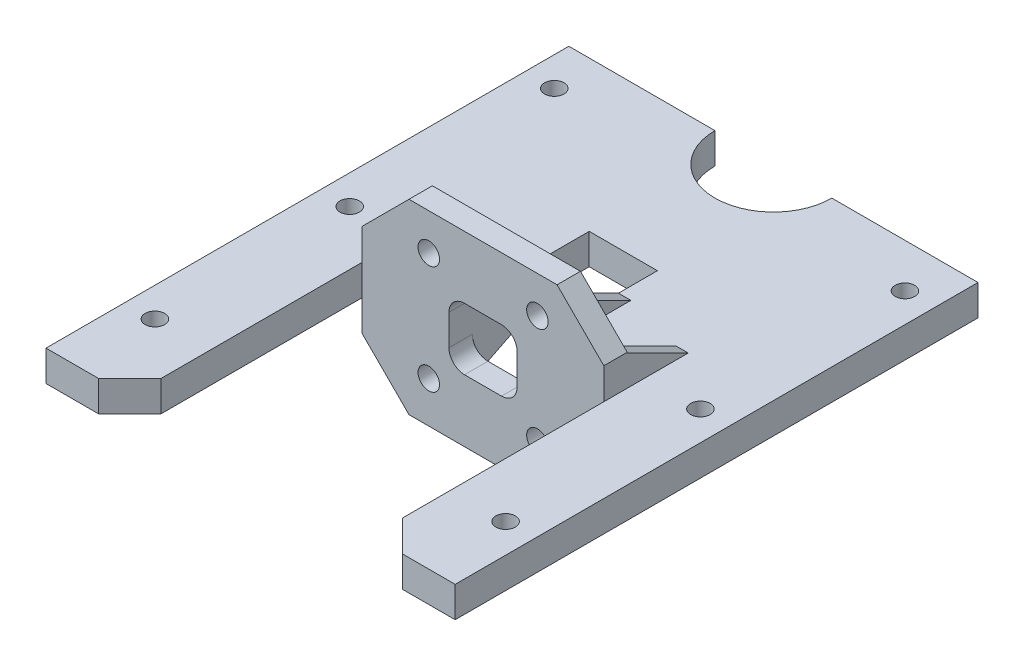
from build123d import *

# Parameters (mm, degrees)
SKETCH1_R           = 1.5875
BOSS_EXTRUDE1_DEPTH = 5
SKETCH2_W           = 39.37
SKETCH2_H           = 30.4
BOSS_EXTRUDE2_DEPTH = 3.81
SKETCH3_W           = 11.1125
SKETCH3_H           = 10.08
CUT_EXTRUDE1_DEPTH  = 3.81
FILLET1_R           = 2.54
CHAMFER1_SIZE       = 7.62
CHAMFER2_SIZE       = 5.08
BOSS_EXTRUDE3_DEPTH = 2.032
BOSS_EXTRUDE4_DEPTH = 2.032
BOSS_EXTRUDE5_DEPTH = 2.032
BOSS_EXTRUDE6_DEPTH = 2.032
SKETCH8_R           = 1.75
SKETCH8_R_2         = 1.7499965
CUT_EXTRUDE2_DEPTH  = 20.32
SKETCH9_R           = 3
CUT_EXTRUDE3_DEPTH  = 10.16
BOSS_EXTRUDE7_DEPTH = 2.032
BOSS_EXTRUDE8_DEPTH = 2.032


with BuildPart() as part:
    # Sketch1 → Boss-Extrude1 (new body)
    with BuildSketch(Plane(origin=(0, 0, 0), x_dir=(1, 0, 0), z_dir=(0, 1, 0))):
        with BuildLine():
            Line((-33.3375, 0), (-19.685, 0))
            Line((-19.685, 0), (-19.685, 41.68899781))
            Line((-19.685, 41.68899781), (-5.55625, 41.68899781))
            Line((-5.55625, 41.68899781), (-5.55625, 60.73899781))
            Line((-5.55625, 60.73899781), (5.55625, 60.73899781))
            Line((5.55625, 60.73899781), (5.55625, 41.68899781))
            Line((5.55625, 41.68899781), (19.685, 41.68899781))
            Line((19.685, 41.68899781), (19.685, 0))
            Line((19.685, 0), (33.3375, 0))
            Line((33.3375, 0), (33.3375, 85.198868165))
            Line((33.3375, 85.198868165), (9.525, 85.198868165))
            ThreePointArc((9.525, 85.198868165), (0, 75.673868165), (-9.525, 85.198868165))
            Line((-9.525, 85.198868165), (-33.3375, 85.198868165))
            Line((-33.3375, 85.198868165), (-33.3375, 0))
        make_face()
        with Locations(Location((-28.575, 12.975059538, 0), (0, 0, 270))):
            Circle(SKETCH1_R, mode=Mode.SUBTRACT)
        with Locations(Location((28.575, 12.975059538, 0), (0, 0, 270))):
            Circle(SKETCH1_R, mode=Mode.SUBTRACT)
        with Locations(Location((-28.575, 44.725059538, 0), (0, 0, 270))):
            Circle(SKETCH1_R, mode=Mode.SUBTRACT)
        with Locations(Location((-28.575, 78.062559538, 0), (0, 0, 270))):
            Circle(SKETCH1_R, mode=Mode.SUBTRACT)
        with Locations(Location((28.575, 44.725059538, 0), (0, 0, 270))):
            Circle(SKETCH1_R, mode=Mode.SUBTRACT)
        with Locations(Location((28.575, 78.062559538, 0), (0, 0, 270))):
            Circle(SKETCH1_R, mode=Mode.SUBTRACT)
    extrude(amount=BOSS_EXTRUDE1_DEPTH)

    # Sketch2 → Boss-Extrude2 (add)
    with BuildSketch(Plane.XY.offset(-41.68899781)):
        with Locations((0, 2.5)):
            Rectangle(SKETCH2_W, SKETCH2_H)
    extrude(amount=BOSS_EXTRUDE2_DEPTH)

    # Sketch3 → Cut-Extrude1 (cut)
    with BuildSketch(Plane(origin=(0, 0, -41.68899781), x_dir=(-1, 0, 0), z_dir=(0, 0, -1))):
        with Locations((0, 2.5)):
            Rectangle(SKETCH3_W, SKETCH3_H)
    extrude(amount=-CUT_EXTRUDE1_DEPTH, mode=Mode.SUBTRACT)

    # Fillet1
    fillet1_edges = [part.edges().sort_by_distance(p)[0] for p in [
        (5.55625, -2.54, -39.78399781),
        (-5.55625, -2.54, -39.78399781),
        (5.55625, 7.54, -39.78399781),
        (-5.55625, 7.54, -39.78399781),
    ]]
    fillet(fillet1_edges, radius=FILLET1_R)

    # Chamfer1
    chamfer1_edges = [part.edges().sort_by_distance(p)[0] for p in [
        (19.685, -12.7, -39.78399781),
        (-19.685, 17.7, -39.78399781),
        (-19.685, -12.7, -39.78399781),
        (19.685, 17.7, -39.78399781),
    ]]
    chamfer(chamfer1_edges, length=CHAMFER1_SIZE)

    # Chamfer2
    chamfer2_edges = [part.edges().sort_by_distance(p)[0] for p in [
        (19.685, 2.5, 0),
        (-19.685, 2.5, 0),
    ]]
    chamfer(chamfer2_edges, length=CHAMFER2_SIZE)

    # Sketch4 → Boss-Extrude3 (add)
    with BuildSketch(Plane.ZY.offset(-5.55625)):
        Polygon((-41.68899781, 5), (-54.38899781, 5), (-41.68899781, 11.35), align=None)
    extrude(amount=-BOSS_EXTRUDE3_DEPTH)

    # Sketch5 → Boss-Extrude4 (add)
    with BuildSketch(Plane(origin=(-5.55625, 0, 0), x_dir=(0, 0, -1), z_dir=(1, 0, 0))):
        Polygon((54.38899781, 5), (41.68899781, 5), (41.68899781, 11.35), align=None)
    extrude(amount=-BOSS_EXTRUDE4_DEPTH)

    # Sketch6 → Boss-Extrude5 (add)
    with BuildSketch(Plane(origin=(-5.55625, 0, 0), x_dir=(0, 0, -1), z_dir=(1, 0, 0))):
        Polygon((41.68899781, 0), (54.38899781, 0), (41.68899781, -6.35), align=None)
    extrude(amount=-BOSS_EXTRUDE5_DEPTH)

    # Sketch7 → Boss-Extrude6 (add)
    with BuildSketch(Plane.ZY.offset(-5.55625)):
        Polygon((-41.68899781, 0), (-54.38899781, 0), (-41.68899781, -6.35), align=None)
    extrude(amount=-BOSS_EXTRUDE6_DEPTH)

    # Sketch8 → Cut-Extrude2 (cut)
    with BuildSketch(Plane.XY.offset(-37.87899781)):
        with Locations((-8.841749375, 11.716378166)):
            Circle(SKETCH8_R)
        with Locations((8.85825, 11.721080704)):
            Circle(SKETCH8_R)
        with Locations((8.85825, -5.978919296)):
            Circle(SKETCH8_R)
        with Locations((-8.841749375, -5.983621834)):
            Circle(SKETCH8_R_2)
    extrude(amount=-CUT_EXTRUDE2_DEPTH, mode=Mode.SUBTRACT)

    # Sketch9 → Cut-Extrude3 (cut)
    with BuildSketch(Plane(origin=(0, 0, -41.68899781), x_dir=(-1, 0, 0), z_dir=(0, 0, -1))):
        with Locations((-8.85825, 11.721080704)):
            Circle(SKETCH9_R)
        with Locations((8.841749375, 11.716378166)):
            Circle(SKETCH9_R)
        with Locations((8.841749375, -5.983621834)):
            Circle(SKETCH9_R)
        with Locations((-8.85825, -5.978919296)):
            Circle(SKETCH9_R)
    extrude(amount=CUT_EXTRUDE3_DEPTH, mode=Mode.SUBTRACT)

    # Sketch10 → Boss-Extrude7 (add)
    with BuildSketch(Plane(origin=(19.685, 0, 0), x_dir=(0, 0, -1), z_dir=(1, 0, 0))):
        Polygon((41.68899781, 9.971080704), (51.631159218, 5), (41.68899781, 5), align=None)
        Polygon((41.68899781, -5.08), (51.84899781, 0), (41.68899781, 0), align=None)
    extrude(amount=-BOSS_EXTRUDE7_DEPTH)

    # Sketch11 → Boss-Extrude8 (add)
    with BuildSketch(Plane.ZY.offset(19.685)):
        Polygon((-41.68899781, 10.08), (-51.84899781, 5), (-41.68899781, 5), align=None)
        Polygon((-41.68899781, -5.08), (-41.68899781, 0), (-51.84899781, 0), align=None)
    extrude(amount=-BOSS_EXTRUDE8_DEPTH)


solid = part.part
